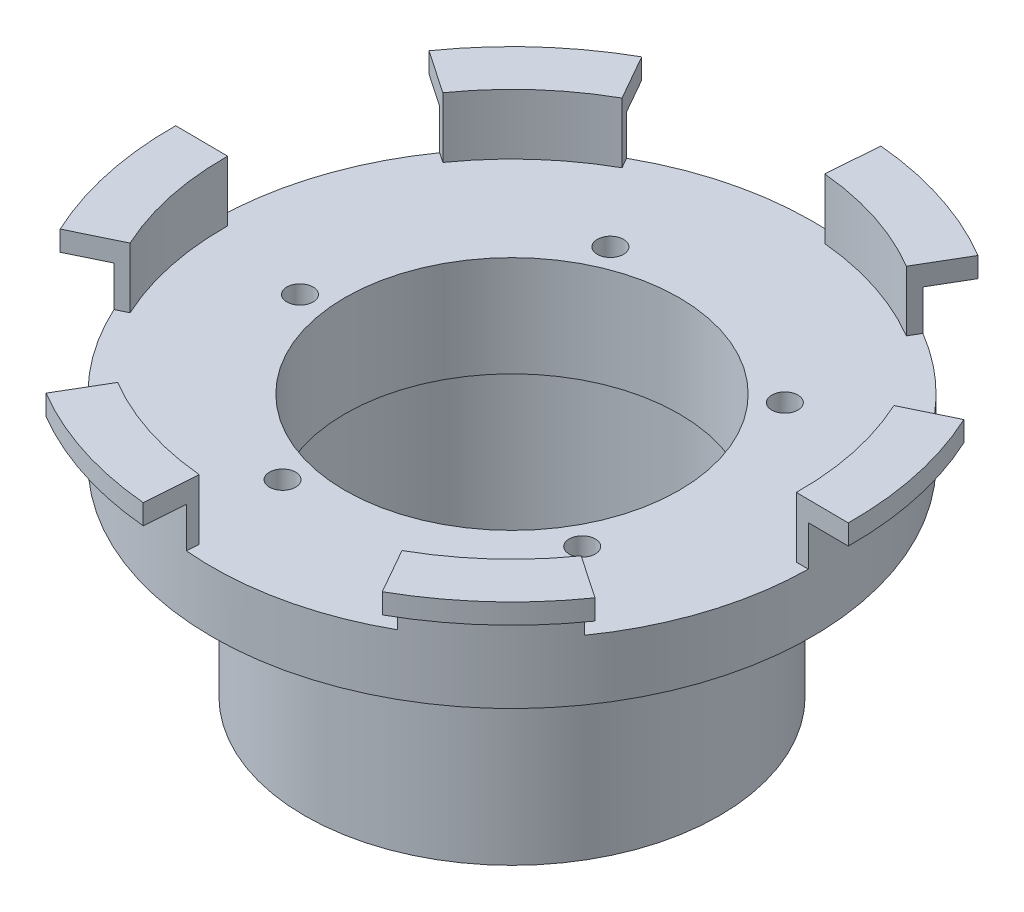
from build123d import *
from build123d.topology import SkipClean

# Parameters (mm, degrees)
SKETCH1_R           = 71.5
SKETCH1_R_2         = 41.5
SKETCH1_R_3         = 3.25
BOSS_EXTRUDE1_DEPTH = 15
SKETCH3_R           = 74.5
SKETCH3_R_2         = 71.5
BOSS_EXTRUDE2_DEPTH = 30
BOSS_EXTRUDE3_START = -5
SKETCH4_R           = 84.5
SKETCH4_R_2         = 74.5
BOSS_EXTRUDE3_DEPTH = 5
BOSS_EXTRUDE4_START = 50
SKETCH5_R           = 51.5
SKETCH5_R_2         = 41.5
BOSS_EXTRUDE4_DEPTH = 50
SKETCH6_R           = 44.5
SKETCH6_R_2         = 41.5
CUT_EXTRUDE1_DEPTH  = 40
CUT_EXTRUDE3_REACH  = 159.061
CIRPATTERN1_COUNT   = 6


with BuildPart() as part:
    # Sketch1 → Boss-Extrude1 (new body)
    with BuildSketch(Plane(origin=(0, 0, 0), x_dir=(1, 0, 0), z_dir=(0, 1, 0))):
        with Locations(Location((-1.336232833, 19.905228099, 0), (0, 0, 270))):
            Circle(SKETCH1_R)
        with Locations(Location((-1.336232833, 19.905228099, 0), (0, 0, 270))):
            Circle(SKETCH1_R_2, mode=Mode.SUBTRACT)
        with Locations(Location((40.185857772, -4.176216869, 0), (0, 0, 270))):
            Circle(SKETCH1_R_3, mode=Mode.SUBTRACT)
        with Locations(Location((34.397613964, 51.953507196, 0), (0, 0, 270))):
            Circle(SKETCH1_R_3, mode=Mode.SUBTRACT)
        with Locations(Location((-20.773591569, 63.793598829, 0), (0, 0, 270))):
            Circle(SKETCH1_R_3, mode=Mode.SUBTRACT)
        with Locations(Location((-49.083027981, 14.981453825, 0), (0, 0, 270))):
            Circle(SKETCH1_R_3, mode=Mode.SUBTRACT)
        with Locations(Location((-11.408016353, -27.026202486, 0), (0, 0, 270))):
            Circle(SKETCH1_R_3, mode=Mode.SUBTRACT)
    extrude(amount=BOSS_EXTRUDE1_DEPTH)

    # Sketch3 → Boss-Extrude2 (add)
    with BuildSketch(Plane.XZ):
        with Locations(Location((-1.336232833, -19.905228099, 0), (0, 0, 270))):
            Circle(SKETCH3_R)
        with Locations(Location((-1.336232833, -19.905228099, 0), (0, 0, 270))):
            Circle(SKETCH3_R_2, mode=Mode.SUBTRACT)
    extrude(amount=-BOSS_EXTRUDE2_DEPTH)

    # Sketch4 → Boss-Extrude3 (add)
    with BuildSketch(Plane(origin=(0, 30, 0), x_dir=(1, 0, 0), z_dir=(0, 1, 0)).offset(BOSS_EXTRUDE3_START)):
        with Locations(Location((-1.336232833, 19.905228099, 0), (0, 0, 270))):
            Circle(SKETCH4_R)
        with Locations(Location((-1.336232833, 19.905228099, 0), (0, 0, 90))):
            Circle(SKETCH4_R_2, mode=Mode.SUBTRACT)
    extrude(amount=BOSS_EXTRUDE3_DEPTH)

    # Sketch5 → Boss-Extrude4 (add)
    with SkipClean():  # the faces are left unmerged after this step: merging them gives an invalid solid
        with BuildSketch(Plane.XZ.offset(BOSS_EXTRUDE4_START)):
            with Locations(Location((-1.336232833, -19.905228099, 0), (0, 0, 270))):
                Circle(SKETCH5_R)
            with Locations(Location((-1.336232833, -19.905228099, 0), (0, 0, 270))):
                Circle(SKETCH5_R_2, mode=Mode.SUBTRACT)
        extrude(amount=-BOSS_EXTRUDE4_DEPTH)

    # Sketch6 → Cut-Extrude1 (cut)
    with SkipClean():  # the faces are left unmerged after this step: merging them gives an invalid solid
        with BuildSketch(Plane.XZ.offset(50)):
            with Locations(Location((-1.336232833, -19.905228099, 0), (0, 0, 270))):
                Circle(SKETCH6_R)
            with Locations(Location((-1.336232833, -19.905228099, 0), (0, 0, 270))):
                Circle(SKETCH6_R_2, mode=Mode.SUBTRACT)
        extrude(amount=-CUT_EXTRUDE1_DEPTH, mode=Mode.SUBTRACT)

    # Cut-Extrude3: up to this face of the body (flat: up to its plane)
    cut_extrude3_end = Plane(part.part.faces().sort_by_distance((-1.336232833, 15, 49.572446507))[0])
    # Sketch7 → Cut-Extrude3 (cut, up to the picked face)
    with BuildSketch(Plane(origin=(0, 30, 0), x_dir=(1, 0, 0), z_dir=(0, 1, 0)), mode=Mode.PRIVATE) as cut_extrude3_sk1:
        with BuildLine():
            Line((19.950155792, 55.530214545), (41.736818688, 92.602973818))
            ThreePointArc((41.736818688, 92.602973818), (61.316730337, 76.60493009), (75.28693821, 55.530214545))
            Line((75.28693821, 55.530214545), (36.551951119, 36.83849467))
            ThreePointArc((36.551951119, 36.83849467), (29.69202216, 47.464208343), (19.950155792, 55.530214545))
        make_face()
    cut_extrude3_tool1 = split(extrude(cut_extrude3_sk1.sketch, amount=-CUT_EXTRUDE3_REACH, mode=Mode.PRIVATE), bisect_by=cut_extrude3_end, keep=Keep.BOTH, mode=Mode.PRIVATE)
    cut_extrude3 = cut_extrude3_tool1.solids().sort_by(Axis((46.525218, 30, -62.990875), (0, -1, 0)))[0]
    add(cut_extrude3, mode=Mode.SUBTRACT)

    # CirPattern1: Cut-Extrude3 ×6 about axis
    with SkipClean():  # the faces are left unmerged after this step: merging them gives an invalid solid
        cirpattern1_axis = Axis((-1.336232833, 0, -19.905228099), (0, 1, 0))
        for i in range(1, CIRPATTERN1_COUNT):
            add(cut_extrude3.rotate(cirpattern1_axis, i * 360 / CIRPATTERN1_COUNT), mode=Mode.SUBTRACT)


solid = part.part
